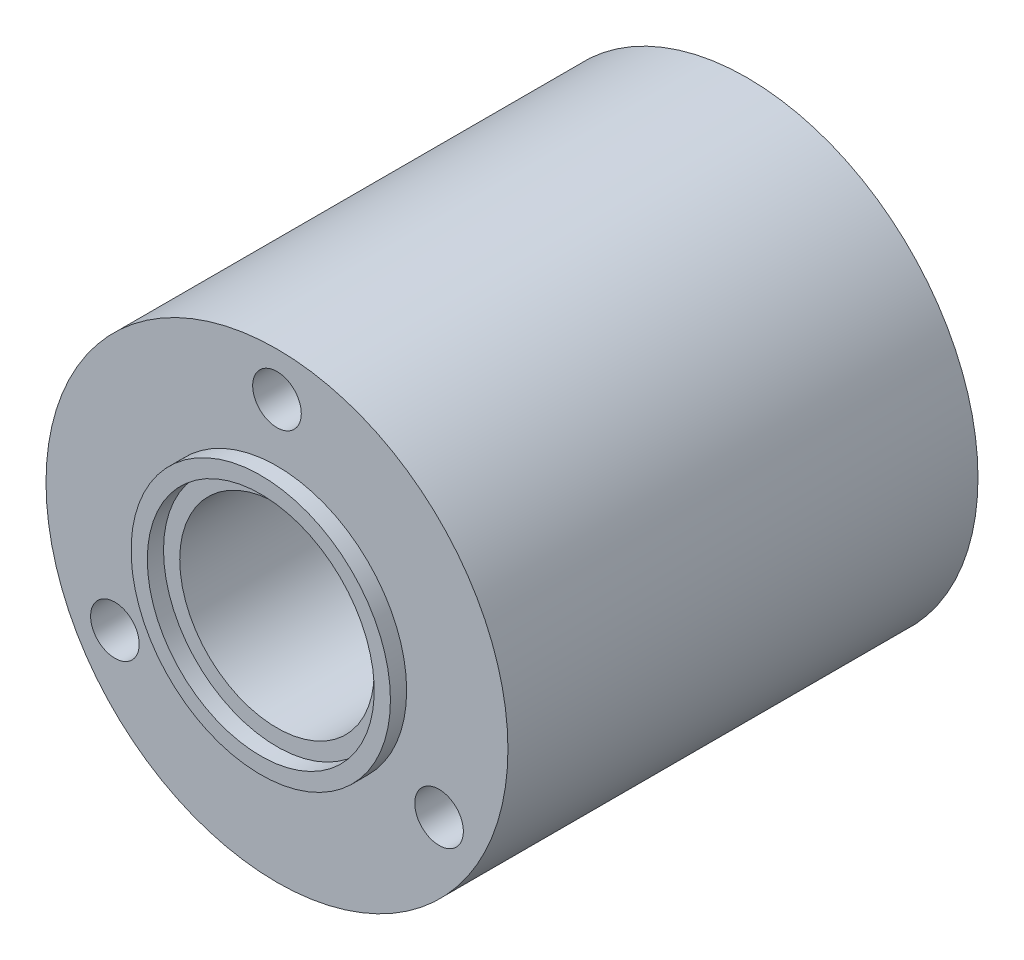
from build123d import *

# Parameters (mm, degrees)
SKETCH1_R           = 14.25
SKETCH1_R_2         = 7
BOSS_EXTRUDE1_DEPTH = 29
SKETCH2_R           = 8
SKETCH2_R_2         = 7
BOSS_EXTRUDE2_DEPTH = 1
SKETCH3_R           = 1.5
CUT_EXTRUDE1_DEPTH  = 37.140351409
SKETCH4_R           = 7
SKETCH4_R_2         = 6
BOSS_EXTRUDE3_DEPTH = 29


with BuildPart() as part:
    # Sketch1 → Boss-Extrude1 (new body)
    with BuildSketch(Plane.XY):
        with Locations(Location((0, 0, 0), (0, 0, 180))):
            Circle(SKETCH1_R)
        with Locations(Location((0, 0, 0), (0, 0, 180))):
            Circle(SKETCH1_R_2, mode=Mode.SUBTRACT)
    extrude(amount=BOSS_EXTRUDE1_DEPTH)

    # Sketch2 → Boss-Extrude2 (add)
    with BuildSketch(Plane.XY.offset(29)):
        Circle(SKETCH2_R)
        with Locations(Location((0, 0, 0), (0, 0, 180))):
            Circle(SKETCH2_R_2, mode=Mode.SUBTRACT)
    boss_extrude2 = extrude(amount=BOSS_EXTRUDE2_DEPTH)

    # Mirror1: Boss-Extrude2 across plane
    add(boss_extrude2.mirror(Plane.XY.offset(14.5)))

    # Sketch3 → Cut-Extrude1 (cut, through all)
    with BuildSketch(Plane.XY.offset(29)):
        with Locations((0, 11.547005384)):
            Circle(SKETCH3_R)
        with Locations((10, -5.773502692)):
            Circle(SKETCH3_R)
        with Locations((-10, -5.773502692)):
            Circle(SKETCH3_R)
    extrude(amount=-CUT_EXTRUDE1_DEPTH, mode=Mode.SUBTRACT)

    # Sketch4 → Boss-Extrude3 (add)
    with BuildSketch(Plane.XY.offset(29)):
        with Locations(Location((0, 0, 0), (0, 0, 180))):
            Circle(SKETCH4_R)
        Circle(SKETCH4_R_2, mode=Mode.SUBTRACT)
    extrude(amount=-BOSS_EXTRUDE3_DEPTH)


solid = part.part
